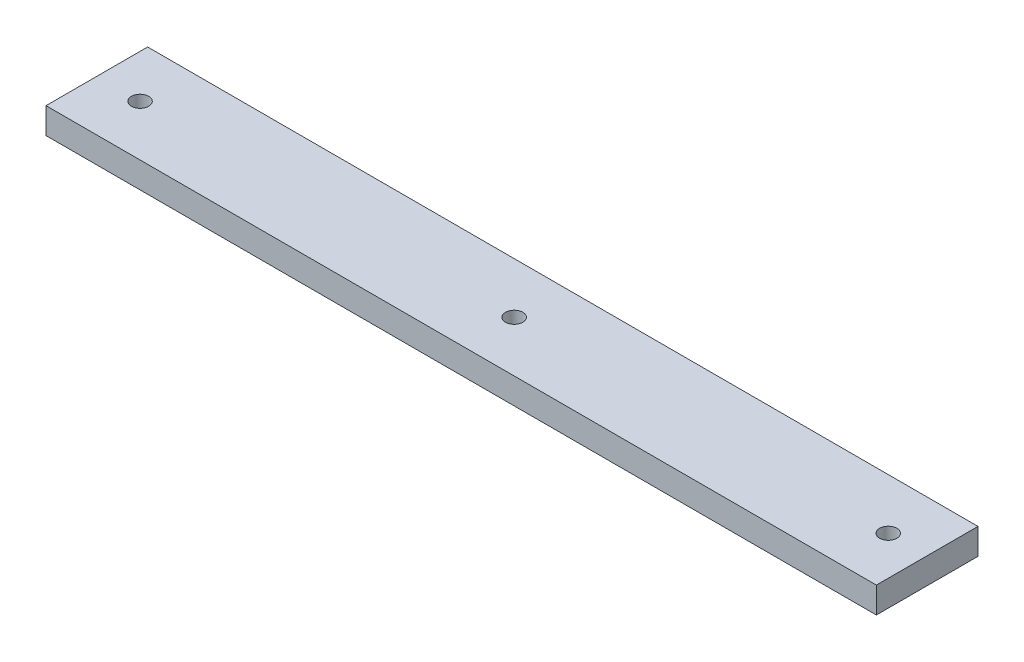
from build123d import *

# Parameters (mm, degrees)
SKETCH1_W           = 609.6
SKETCH1_H           = 74.6125
BOSS_EXTRUDE1_DEPTH = 19.05
SKETCH2_R           = 3.175
CUT_EXTRUDE1_DEPTH  = 9.525
CUT_EXTRUDE2_START  = -9.525
SKETCH4_R           = 6.35
CUT_EXTRUDE2_DEPTH  = 9.525
SKETCH5_R           = 3.175
CUT_EXTRUDE3_DEPTH  = 9.525
CUT_EXTRUDE4_START  = -9.525
SKETCH6_R           = 6.35
CUT_EXTRUDE4_DEPTH  = 9.525
SKETCH7_R           = 3.175
CUT_EXTRUDE5_DEPTH  = 9.525
CUT_EXTRUDE6_START  = -9.525
SKETCH8_R           = 6.35
CUT_EXTRUDE6_DEPTH  = 9.525


with BuildPart() as part:
    # Sketch1 → Boss-Extrude1 (new body)
    with BuildSketch(Plane(origin=(0, 0, 0), x_dir=(1, 0, 0), z_dir=(0, 1, 0))):
        Rectangle(SKETCH1_W, SKETCH1_H)
    extrude(amount=BOSS_EXTRUDE1_DEPTH)

    # Sketch2 → Cut-Extrude1 (cut)
    with BuildSketch(Plane.XZ):
        with Locations(Location((1.5875, 0, 0), (0, 0, 270))):
            Circle(SKETCH2_R)
    extrude(amount=-CUT_EXTRUDE1_DEPTH, mode=Mode.SUBTRACT)

    # Sketch4 → Cut-Extrude2 (cut)
    with BuildSketch(Plane.XZ.offset(CUT_EXTRUDE2_START)):
        with Locations(Location((1.5875, 0, 0), (0, 0, 270))):
            Circle(SKETCH4_R)
    extrude(amount=-CUT_EXTRUDE2_DEPTH, mode=Mode.SUBTRACT)

    # Sketch5 → Cut-Extrude3 (cut)
    with BuildSketch(Plane.XZ):
        with Locations(Location((276.225, 0, 0), (0, 0, 270))):
            Circle(SKETCH5_R)
    extrude(amount=-CUT_EXTRUDE3_DEPTH, mode=Mode.SUBTRACT)

    # Sketch6 → Cut-Extrude4 (cut)
    with BuildSketch(Plane.XZ.offset(CUT_EXTRUDE4_START)):
        with Locations(Location((276.225, 0, 0), (0, 0, 270))):
            Circle(SKETCH6_R)
    extrude(amount=-CUT_EXTRUDE4_DEPTH, mode=Mode.SUBTRACT)

    # Sketch7 → Cut-Extrude5 (cut)
    with BuildSketch(Plane.XZ):
        with Locations(Location((-273.05, 0, 0), (0, 0, 270))):
            Circle(SKETCH7_R)
    extrude(amount=-CUT_EXTRUDE5_DEPTH, mode=Mode.SUBTRACT)

    # Sketch8 → Cut-Extrude6 (cut)
    with BuildSketch(Plane.XZ.offset(CUT_EXTRUDE6_START)):
        with Locations(Location((-273.05, 0, 0), (0, 0, 270))):
            Circle(SKETCH8_R)
    extrude(amount=-CUT_EXTRUDE6_DEPTH, mode=Mode.SUBTRACT)


solid = part.part
